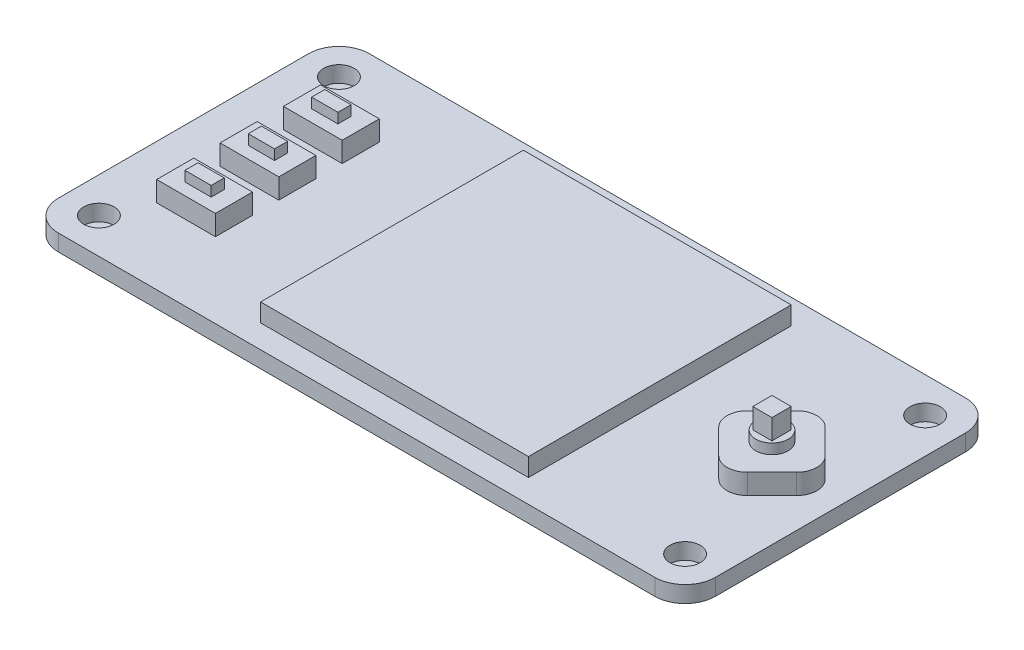
from build123d import *

# Parameters (mm, degrees)
EXTRUDE_1_DEPTH     = 1.63
SKETCH_2_R          = 1.5
CUT_EXTRUDE_1_DEPTH = 1.6
SKETCH_3_W          = 26.5
SKETCH_3_H          = 26
EXTRUDE_2_DEPTH     = 1.8
EXTRUDE_3_DEPTH     = 2
SKETCH_4_W          = 5.81
SKETCH_4_H          = 3.67
EXTRUDE_4_DEPTH     = 2
SKETCH_7_W          = 2.6
SKETCH_7_H          = 1.3
EXTRUDE_5_DEPTH     = 1
SKETCH_8_W          = 51
SKETCH_8_H          = 5
EXTRUDE_6_DEPTH     = 3.68
SKETCH_9_W          = 1.9
SKETCH_9_H          = 1.9
EXTRUDE_7_DEPTH     = 3
SKETCH_10_R         = 1.6
EXTRUDE_8_DEPTH     = 1


with BuildPart() as part:
    # 草图1 → 凸台-拉伸1 (new body)
    with BuildSketch(Plane(origin=(0, 0, 0), x_dir=(1, 0, 0), z_dir=(0, 1, 0))):
        with BuildLine():
            Line((-29.5, 15.375), (29.5, 15.375))
            ThreePointArc((29.5, 15.375), (31.621320344, 14.496320344), (32.5, 12.375))
            Line((32.5, 12.375), (32.5, -12.375))
            ThreePointArc((32.5, -12.375), (31.621320344, -14.496320344), (29.5, -15.375))
            Line((29.5, -15.375), (-29.5, -15.375))
            ThreePointArc((-29.5, -15.375), (-31.621320344, -14.496320344), (-32.5, -12.375))
            Line((-32.5, -12.375), (-32.5, 12.375))
            ThreePointArc((-32.5, 12.375), (-31.621320344, 14.496320344), (-29.5, 15.375))
        make_face()
    extrude(amount=EXTRUDE_1_DEPTH)

    # 草图2 → 切除-拉伸1 (cut)
    with BuildSketch(Plane(origin=(0, 1.63, 0), x_dir=(1, 0, 0), z_dir=(0, 1, 0))):
        with Locations(Location((-29, 11.875, 0), (0, 0, 270))):
            Circle(SKETCH_2_R)
        with Locations(Location((-29, -11.875, 0), (0, 0, 270))):
            Circle(SKETCH_2_R)
        with Locations(Location((29, -11.875, 0), (0, 0, 270))):
            Circle(SKETCH_2_R)
        with Locations(Location((29, 11.875, 0), (0, 0, 270))):
            Circle(SKETCH_2_R)
    extrude(amount=-CUT_EXTRUDE_1_DEPTH, mode=Mode.SUBTRACT)

    # 草图3 → 凸台-拉伸2 (add)
    with BuildSketch(Plane(origin=(0, 1.63, 0), x_dir=(1, 0, 0), z_dir=(0, 1, 0))):
        with Locations((1.45, -0.075)):
            Rectangle(SKETCH_3_W, SKETCH_3_H)
    extrude(amount=EXTRUDE_2_DEPTH)

    # 草图5 → 凸台-拉伸3 (add)
    with BuildSketch(Plane(origin=(0, 1.63, 0), x_dir=(1, 0, 0), z_dir=(0, 1, 0))):
        with BuildLine():
            Line((27.074695167, 3.918250353), (29.514213562, 1.478731957))
            ThreePointArc((29.514213562, 1.478731957), (30.1, 0.064518395), (29.514213562, -1.349695167))
            Line((29.514213562, -1.349695167), (27.074695167, -3.789213562))
            ThreePointArc((27.074695167, -3.789213562), (25.660481605, -4.375), (24.246268043, -3.789213562))
            Line((24.246268043, -3.789213562), (21.806749647, -1.349695167))
            ThreePointArc((21.806749647, -1.349695167), (21.22096321, 0.064518395), (21.806749647, 1.478731957))
            Line((21.806749647, 1.478731957), (24.246268043, 3.918250353))
            ThreePointArc((24.246268043, 3.918250353), (25.660481605, 4.50403679), (27.074695167, 3.918250353))
        make_face()
    extrude(amount=EXTRUDE_3_DEPTH)

    # 草图4 → 凸台-拉伸4 (add)
    with BuildSketch(Plane(origin=(0, 1.63, 0), x_dir=(1, 0, 0), z_dir=(0, 1, 0))):
        with Locations((-24.325, 6.45)):
            Rectangle(SKETCH_4_W, SKETCH_4_H)
        with Locations((-24.325, 0.18)):
            Rectangle(SKETCH_4_W, SKETCH_4_H)
        with Locations((-24.325, -6.09)):
            Rectangle(SKETCH_4_W, SKETCH_4_H)
    extrude(amount=EXTRUDE_4_DEPTH)

    # 草图7 → 凸台-拉伸5 (add)
    with BuildSketch(Plane(origin=(0, 3.63, 0), x_dir=(1, 0, 0), z_dir=(0, 1, 0))):
        with Locations((-24.325, 6.45)):
            Rectangle(SKETCH_7_W, SKETCH_7_H)
        with Locations((-24.325, 0.18)):
            Rectangle(SKETCH_7_W, SKETCH_7_H)
        with Locations((-24.325, -6.09)):
            Rectangle(SKETCH_7_W, SKETCH_7_H)
    extrude(amount=EXTRUDE_5_DEPTH)

    # 草图8 → 凸台-拉伸6 (add)
    with BuildSketch(Plane.XZ):
        with Locations((-0.2, -11.235)):
            Rectangle(SKETCH_8_W, SKETCH_8_H)
    extrude(amount=EXTRUDE_6_DEPTH)

    # 草图9 → 凸台-拉伸7 (add)
    with BuildSketch(Plane(origin=(0, 3.63, 0), x_dir=(1, 0, 0), z_dir=(0, 1, 0))):
        with Locations((25.660481605, 0.064518395)):
            Rectangle(SKETCH_9_W, SKETCH_9_H)
    extrude(amount=EXTRUDE_7_DEPTH)

    # 草图10 → 凸台-拉伸8 (add)
    with BuildSketch(Plane(origin=(0, 3.63, 0), x_dir=(1, 0, 0), z_dir=(0, 1, 0))):
        with Locations(Location((25.660481605, 0.064518395, 0), (0, 0, 90))):
            Circle(SKETCH_10_R)
    extrude(amount=EXTRUDE_8_DEPTH)


solid = part.part
